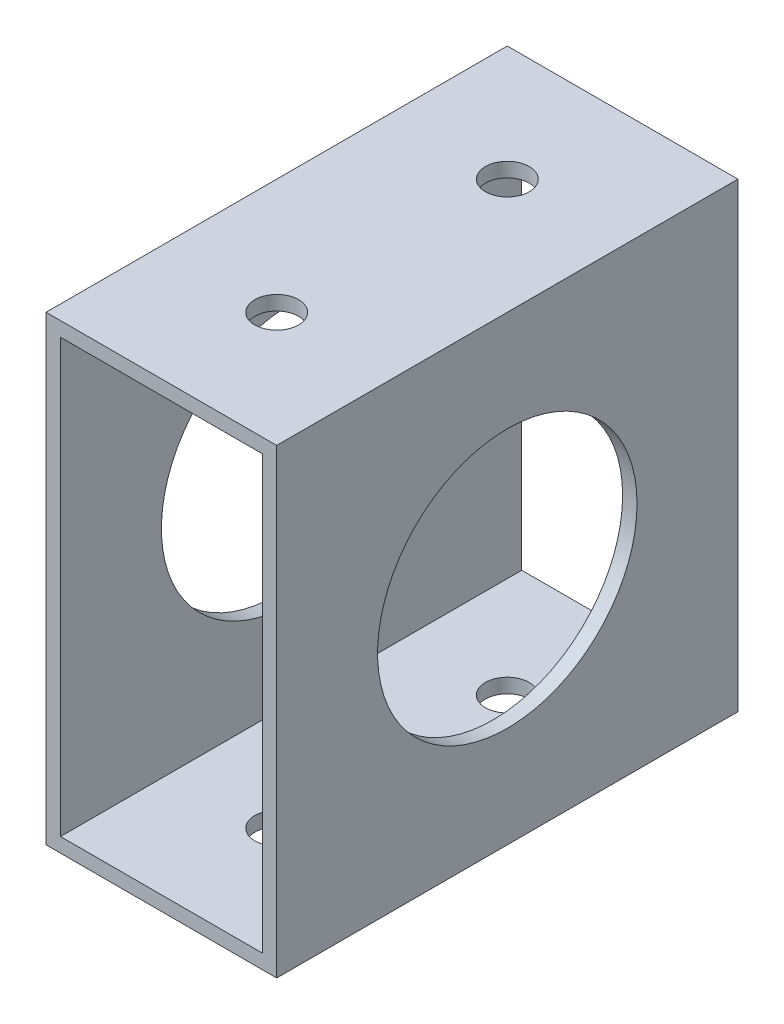
from build123d import *

# Parameters (mm, degrees)
SKETCH1_W           = 25.4
SKETCH1_H           = 50.8
SKETCH1_W_2         = 22.225
SKETCH1_H_2         = 47.625
BOSS_EXTRUDE1_DEPTH = 50.8
SKETCH2_R           = 2.413
CUT_EXTRUDE1_DEPTH  = 77.2
SKETCH3_R           = 14.2875
CUT_EXTRUDE2_DEPTH  = 77.2


with BuildPart() as part:
    # Sketch1 → Boss-Extrude1 (new body)
    with BuildSketch(Plane.XY):
        with Locations((12.7, 25.4)):
            Rectangle(SKETCH1_W, SKETCH1_H)
        with Locations((12.7, 25.4)):
            Rectangle(SKETCH1_W_2, SKETCH1_H_2, mode=Mode.SUBTRACT)
    extrude(amount=BOSS_EXTRUDE1_DEPTH)

    # Sketch2 → Cut-Extrude1 (cut, through all)
    with BuildSketch(Plane(origin=(0, 50.8, 0), x_dir=(1, 0, 0), z_dir=(0, 1, 0))):
        with Locations(Location((12.7, -12.7, 0), (0, 0, 270))):
            Circle(SKETCH2_R)
        with Locations(Location((12.7, -38.1, 0), (0, 0, 270))):
            Circle(SKETCH2_R)
    extrude(amount=-CUT_EXTRUDE1_DEPTH, mode=Mode.SUBTRACT)

    # Sketch3 → Cut-Extrude2 (cut, through all)
    with BuildSketch(Plane(origin=(25.4, 0, 0), x_dir=(0, 0, -1), z_dir=(1, 0, 0))):
        with Locations((-25.4, 25.4)):
            Circle(SKETCH3_R)
    extrude(amount=-CUT_EXTRUDE2_DEPTH, mode=Mode.SUBTRACT)


solid = part.part
